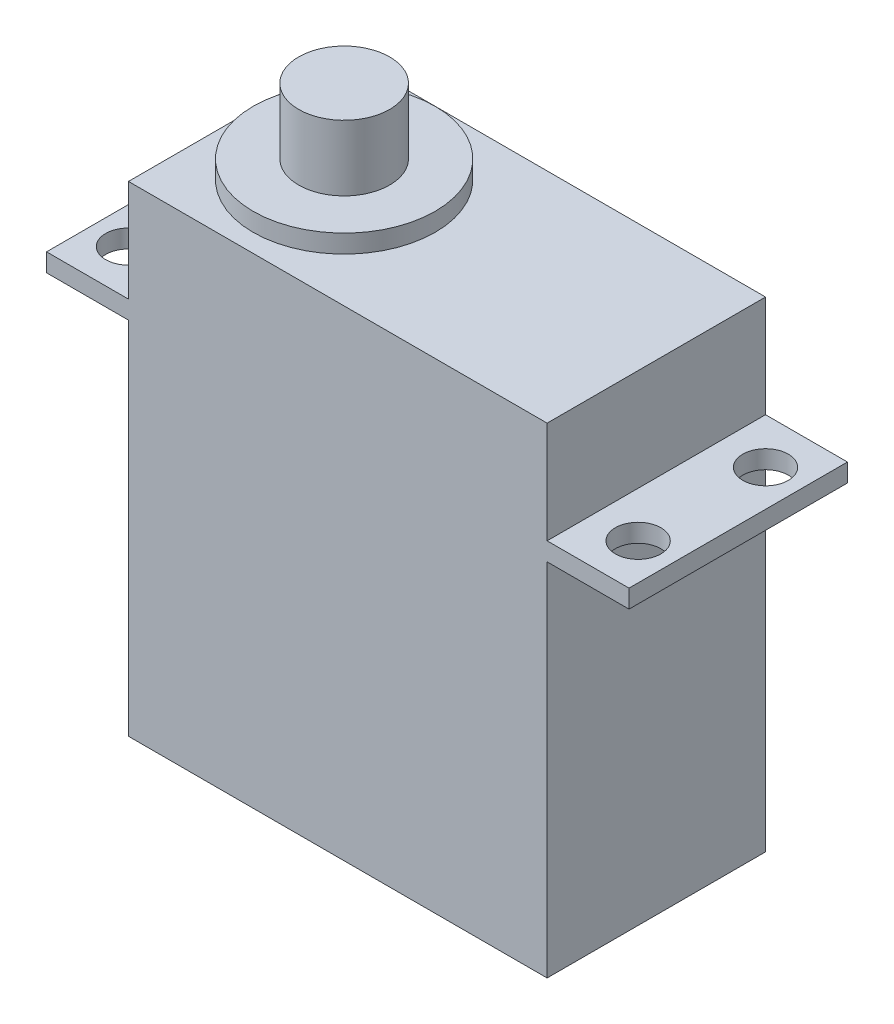
from build123d import *

# Parameters (mm, degrees)
EXTRUDE_1_DEPTH      = 6.6
EXTRUDE_1_DEPTH_BACK = 19.8
SKETCH_1_W           = 23
SKETCH_1_H           = 12
SKETCH_1_3_W         = 4.5
SKETCH_1_3_H         = 12
SKETCH_1_3_R         = 1.25
EXTRUDE_2_DEPTH      = 1
SKETCH_2_R           = 2.5
EXTRUDE_3_DEPTH      = 4.6
SKETCH_3_R           = 5
EXTRUDE_4_DEPTH      = 1


with BuildPart() as part:
    # 草图1 → 凸台-拉伸1 (new, two sides: drawn at the far end of the back side and taken through both)
    with BuildSketch(Plane(origin=(0, 0, 0), x_dir=(1, 0, 0), z_dir=(0, 1, 0)).offset(-EXTRUDE_1_DEPTH_BACK)):
        Rectangle(SKETCH_1_W, SKETCH_1_H)
    extrude(amount=EXTRUDE_1_DEPTH + EXTRUDE_1_DEPTH_BACK)

    # 草图1<3> → 凸台-拉伸2 (add)
    # profile 1 of 2: a face of its own
    with BuildSketch(Plane(origin=(0, 0, 0), x_dir=(1, 0, 0), z_dir=(0, 1, 0))):
        with Locations((-13.75, 0)):
            Rectangle(SKETCH_1_3_W, SKETCH_1_3_H)
        with Locations((-14, -3.5)):
            Circle(SKETCH_1_3_R, mode=Mode.SUBTRACT)
        with Locations((-14, 3.5)):
            Circle(SKETCH_1_3_R, mode=Mode.SUBTRACT)
    # profile 2 of 2: a face of its own
    with BuildSketch(Plane(origin=(0, 0, 0), x_dir=(1, 0, 0), z_dir=(0, 1, 0))):
        with Locations((13.75, 0)):
            Rectangle(SKETCH_1_3_W, SKETCH_1_3_H)
        with Locations((14, -3.5)):
            Circle(SKETCH_1_3_R, mode=Mode.SUBTRACT)
        with Locations((14, 3.5)):
            Circle(SKETCH_1_3_R, mode=Mode.SUBTRACT)
    extrude(amount=EXTRUDE_2_DEPTH)

    # 草图2 → 凸台-拉伸3 (add)
    with BuildSketch(Plane(origin=(0, 6.6, 0), x_dir=(1, 0, 0), z_dir=(0, 1, 0))):
        with Locations((-5.65, 0)):
            Circle(SKETCH_2_R)
    extrude(amount=EXTRUDE_3_DEPTH)

    # 草图3 → 凸台-拉伸4 (add)
    with BuildSketch(Plane(origin=(0, 6.6, 0), x_dir=(1, 0, 0), z_dir=(0, 1, 0))):
        with Locations((-5.65, 0)):
            Circle(SKETCH_3_R)
    extrude(amount=EXTRUDE_4_DEPTH)


solid = part.part
